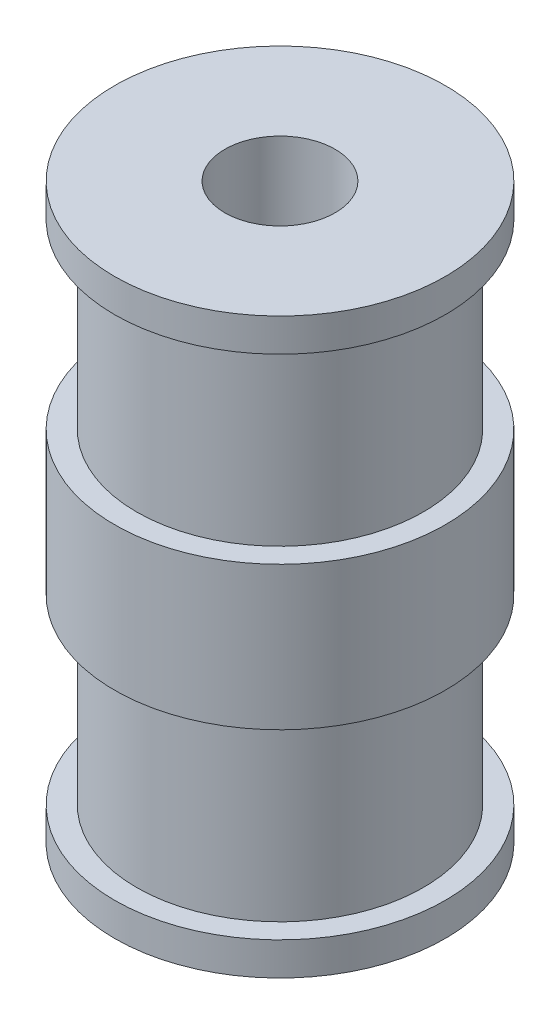
from build123d import *

# Parameters (mm, degrees)
SKETCH1_R           = 7.5
SKETCH1_R_2         = 2.5
BOSS_EXTRUDE1_DEPTH = 1.5
SKETCH2_R           = 6.5
SKETCH2_R_2         = 2.5
BOSS_EXTRUDE2_DEPTH = 8.25
SKETCH3_R           = 7.5
SKETCH3_R_2         = 2.5
BOSS_EXTRUDE3_DEPTH = 6.5
SKETCH4_R           = 6.5
SKETCH4_R_2         = 2.5
BOSS_EXTRUDE4_DEPTH = 8.25
SKETCH5_R           = 7.5
SKETCH5_R_2         = 2.5
BOSS_EXTRUDE5_DEPTH = 1.5


with BuildPart() as part:
    # Sketch1 → Boss-Extrude1 (new body)
    with BuildSketch(Plane(origin=(0, 0, 0), x_dir=(1, 0, 0), z_dir=(0, 1, 0))):
        with Locations(Location((0, 0, 0), (0, 0, 270))):
            Circle(SKETCH1_R)
        with Locations(Location((0, 0, 0), (0, 0, 270))):
            Circle(SKETCH1_R_2, mode=Mode.SUBTRACT)
    extrude(amount=BOSS_EXTRUDE1_DEPTH)

    # Sketch2 → Boss-Extrude2 (add)
    with BuildSketch(Plane(origin=(0, 1.5, 0), x_dir=(1, 0, 0), z_dir=(0, 1, 0))):
        with Locations(Location((0, 0, 0), (0, 0, 270))):
            Circle(SKETCH2_R)
        with Locations(Location((0, 0, 0), (0, 0, 270))):
            Circle(SKETCH2_R_2, mode=Mode.SUBTRACT)
    extrude(amount=BOSS_EXTRUDE2_DEPTH)

    # Sketch3 → Boss-Extrude3 (add)
    with BuildSketch(Plane(origin=(0, 9.75, 0), x_dir=(1, 0, 0), z_dir=(0, 1, 0))):
        with Locations(Location((0, 0, 0), (0, 0, 270))):
            Circle(SKETCH3_R)
        with Locations(Location((0, 0, 0), (0, 0, 270))):
            Circle(SKETCH3_R_2, mode=Mode.SUBTRACT)
    extrude(amount=BOSS_EXTRUDE3_DEPTH)

    # Sketch4 → Boss-Extrude4 (add)
    with BuildSketch(Plane(origin=(0, 16.25, 0), x_dir=(1, 0, 0), z_dir=(0, 1, 0))):
        with Locations(Location((0, 0, 0), (0, 0, 270))):
            Circle(SKETCH4_R)
        with Locations(Location((0, 0, 0), (0, 0, 270))):
            Circle(SKETCH4_R_2, mode=Mode.SUBTRACT)
    extrude(amount=BOSS_EXTRUDE4_DEPTH)

    # Sketch5 → Boss-Extrude5 (add)
    with BuildSketch(Plane(origin=(0, 24.5, 0), x_dir=(1, 0, 0), z_dir=(0, 1, 0))):
        with Locations(Location((0, 0, 0), (0, 0, 270))):
            Circle(SKETCH5_R)
        with Locations(Location((0, 0, 0), (0, 0, 270))):
            Circle(SKETCH5_R_2, mode=Mode.SUBTRACT)
    extrude(amount=BOSS_EXTRUDE5_DEPTH)


solid = part.part
